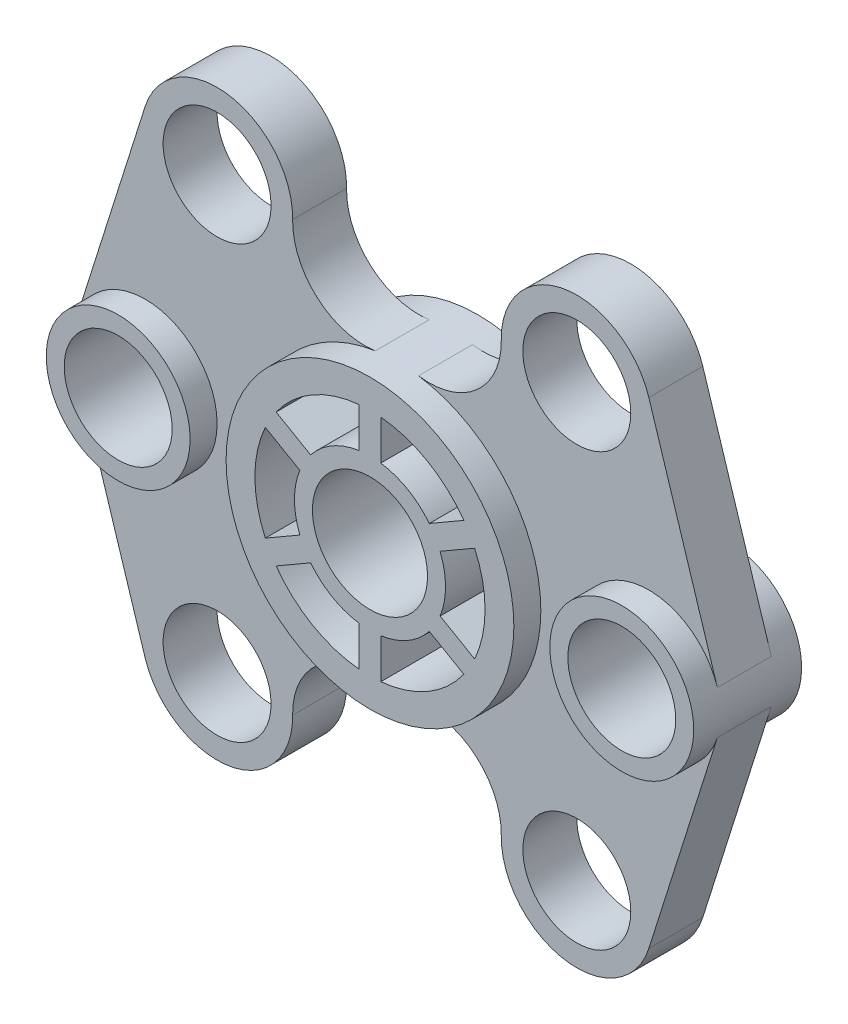
from build123d import *

# Parameters (mm, degrees)
SKETCH1_R             = 20
SKETCH1_R_2           = 15
BOSS_EXTRUDE1_DEPTH   = 15
SKETCH1_R_3           = 40
SKETCH1_R_4           = 16
BOSS_EXTRUDE1_2_DEPTH = 15
BOSS_EXTRUDE1_3_DEPTH = 15
SKETCH1_3_R           = 15
BOSS_EXTRUDE2_DEPTH   = 7.5


with BuildPart() as part:
    # Sketch1 → Boss-Extrude1 (new, symmetric)
    with BuildSketch(Plane.XY):
        with Locations((-70, 0)):
            Circle(SKETCH1_R)
        with Locations((-70, 0)):
            Circle(SKETCH1_R_2, mode=Mode.SUBTRACT)
    extrude(amount=BOSS_EXTRUDE1_DEPTH, both=True)



with BuildPart() as body_2:
    # Sketch1 → Boss-Extrude1 2 (new, symmetric)
    with BuildSketch(Plane.XY):
        Circle(SKETCH1_R_3)
        with BuildLine():
            ThreePointArc((-16.5, -12.990381057), (-10.5, -18.186533479), (-3, -20.784609691))
            Line((-3, -20.784609691), (-3, -31.859064644))
            ThreePointArc((-3, -31.859064644), (-16, -27.712812921), (-26.090759323, -18.527608533))
            Line((-26.090759323, -18.527608533), (-16.5, -12.990381057))
        make_face(mode=Mode.SUBTRACT)
        with BuildLine():
            Line((3, -31.859064644), (3, -20.784609691))
            ThreePointArc((3, -20.784609691), (10.5, -18.186533479), (16.5, -12.990381057))
            Line((16.5, -12.990381057), (26.090759323, -18.527608533))
            ThreePointArc((26.090759323, -18.527608533), (16, -27.712812921), (3, -31.859064644))
        make_face(mode=Mode.SUBTRACT)
        with BuildLine():
            ThreePointArc((19.5, -7.794228634), (21, 0), (19.5, 7.794228634))
            Line((19.5, 7.794228634), (29.090759323, 13.331456111))
            ThreePointArc((29.090759323, 13.331456111), (32, 0), (29.090759323, -13.331456111))
            Line((29.090759323, -13.331456111), (19.5, -7.794228634))
        make_face(mode=Mode.SUBTRACT)
        with BuildLine():
            ThreePointArc((-19.5, 7.794228634), (-21, 0), (-19.5, -7.794228634))
            Line((-19.5, -7.794228634), (-29.090759323, -13.331456111))
            ThreePointArc((-29.090759323, -13.331456111), (-32, 0), (-29.090759323, 13.331456111))
            Line((-29.090759323, 13.331456111), (-19.5, 7.794228634))
        make_face(mode=Mode.SUBTRACT)
        with BuildLine():
            ThreePointArc((-3, 20.784609691), (-10.5, 18.186533479), (-16.5, 12.990381057))
            Line((-16.5, 12.990381057), (-26.090759323, 18.527608533))
            ThreePointArc((-26.090759323, 18.527608533), (-16, 27.712812921), (-3, 31.859064644))
            Line((-3, 31.859064644), (-3, 20.784609691))
        make_face(mode=Mode.SUBTRACT)
        Circle(SKETCH1_R_4, mode=Mode.SUBTRACT)
        with BuildLine():
            ThreePointArc((16.5, 12.990381057), (10.5, 18.186533479), (3, 20.784609691))
            Line((3, 20.784609691), (3, 31.859064644))
            ThreePointArc((3, 31.859064644), (16, 27.712812921), (26.090759323, 18.527608533))
            Line((26.090759323, 18.527608533), (16.5, 12.990381057))
        make_face(mode=Mode.SUBTRACT)
    extrude(amount=BOSS_EXTRUDE1_2_DEPTH, both=True)


with BuildPart() as body_3:
    # Sketch1 → Boss-Extrude1 3 (new, symmetric)
    with BuildSketch(Plane.XY):
        with Locations((70, 0)):
            Circle(SKETCH1_R)
        with Locations((70, 0)):
            Circle(SKETCH1_R_2, mode=Mode.SUBTRACT)
    extrude(amount=BOSS_EXTRUDE1_3_DEPTH, both=True)


with BuildPart() as part_1:
    add(part.part)

    add(body_2.part)  # Boss-Extrude2 merges body 2

    add(body_3.part)  # Boss-Extrude2 merges body 3
    # Sketch1<3> → Boss-Extrude2 (add, symmetric)
    # profile 1 of 2: a face of its own
    with BuildSketch(Plane.XY):
        with BuildLine():
            ThreePointArc((-89.071294105, 6.023764702), (-50, 0), (-89.071294105, -6.023764702))
            Line((-89.071294105, -6.023764702), (-70.02485881, -66.324952937))
            ThreePointArc((-70.02485881, -66.324952937), (-46.6282273, -80.727545655), (-29.002885891, -59.651863383))
            ThreePointArc((-29.002885891, -59.651863383), (-22.168588856, -44.262528341), (-6.003756239, -39.546869801))
            ThreePointArc((-6.003756239, -39.546869801), (-40, 0), (-6.003756239, 39.546869801))
            ThreePointArc((-6.003756239, 39.546869801), (-22.168588856, 44.262528341), (-29.002885891, 59.651863383))
            ThreePointArc((-29.002885891, 59.651863383), (-46.6282273, 80.727545655), (-70.02485881, 66.324952937))
            Line((-70.02485881, 66.324952937), (-89.071294105, 6.023764702))
        make_face()
        with Locations((-50, -60)):
            Circle(SKETCH1_3_R, mode=Mode.SUBTRACT)
        with Locations((-50, 60)):
            Circle(SKETCH1_3_R, mode=Mode.SUBTRACT)
    # profile 2 of 2: a face of its own
    with BuildSketch(Plane.XY):
        with BuildLine():
            ThreePointArc((6.003756239, 39.546869801), (40, 0), (6.003756239, -39.546869801))
            ThreePointArc((6.003756239, -39.546869801), (22.168588856, -44.262528341), (29.002885891, -59.651863383))
            ThreePointArc((29.002885891, -59.651863383), (46.6282273, -80.727545655), (70.02485881, -66.324952937))
            Line((70.02485881, -66.324952937), (89.071294105, -6.023764702))
            ThreePointArc((89.071294105, -6.023764702), (50, 0), (89.071294105, 6.023764702))
            Line((89.071294105, 6.023764702), (70.02485881, 66.324952937))
            ThreePointArc((70.02485881, 66.324952937), (46.6282273, 80.727545655), (29.002885891, 59.651863383))
            ThreePointArc((29.002885891, 59.651863383), (22.168588856, 44.262528341), (6.003756239, 39.546869801))
        make_face()
        with Locations((50, -60)):
            Circle(SKETCH1_3_R, mode=Mode.SUBTRACT)
        with Locations((50, 60)):
            Circle(SKETCH1_3_R, mode=Mode.SUBTRACT)
    extrude(amount=BOSS_EXTRUDE2_DEPTH, both=True)


solid = part_1.part
